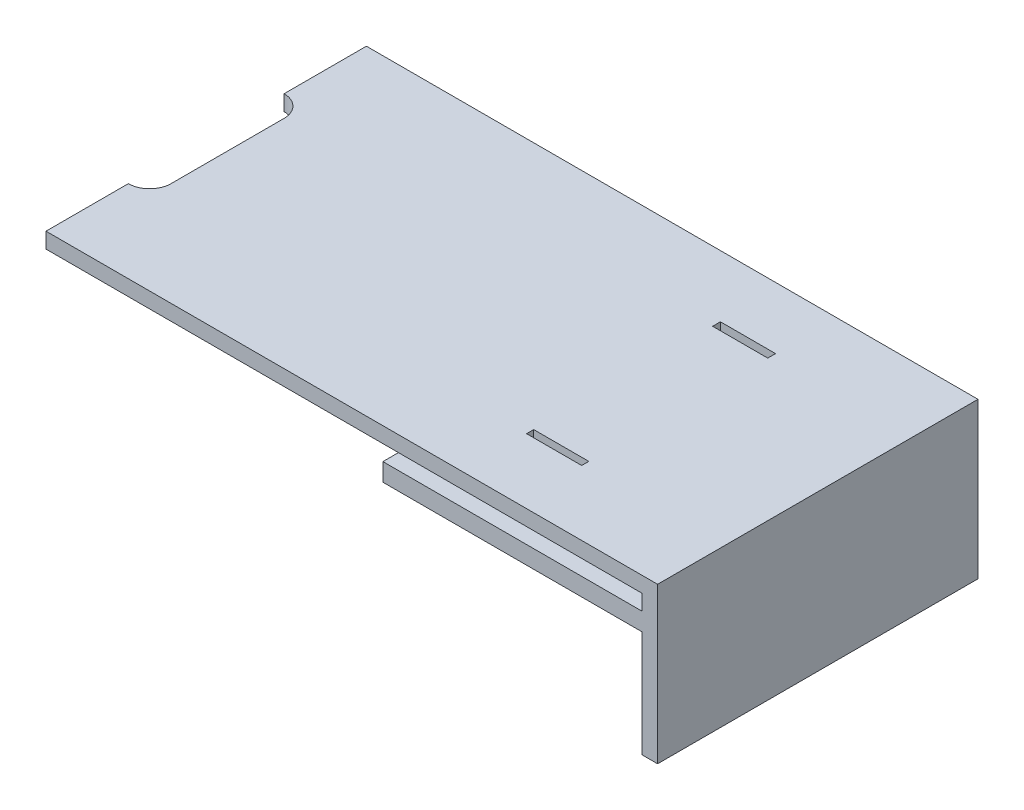
from build123d import *

# Parameters (mm, degrees)
SKETCH1_W            = 115
SKETCH1_H            = 61.82
BOSS_EXTRUDE1_DEPTH  = 3
CUT_EXTRUDE1_DEPTH   = 3
SKETCH3_W            = 61.82
SKETCH3_H            = 30
BOSS_EXTRUDE2_DEPTH  = 3
SKETCH4_W            = 10
SKETCH4_H            = 3.45
BOSS_EXTRUDE3_DEPTH  = 50
SKETCH5_W            = 6
SKETCH5_H            = 2
SKETCH5_W_2          = 2
SKETCH5_H_2          = 6
BOSS_EXTRUDE12_DEPTH = 5
SKETCH8_W            = 10.631694969
SKETCH8_H            = 1.375866407
SKETCH8_H_2          = 1.500945172
CUT_EXTRUDE2_DEPTH   = 5


with BuildPart() as part:
    # Sketch1 → Boss-Extrude1 (new body)
    with BuildSketch(Plane(origin=(0, 0, 0), x_dir=(1, 0, 0), z_dir=(0, 1, 0))):
        Rectangle(SKETCH1_W, SKETCH1_H)
    extrude(amount=BOSS_EXTRUDE1_DEPTH)

    # Sketch2 → Cut-Extrude1 (cut)
    with BuildSketch(Plane(origin=(0, 3, 0), x_dir=(1, 0, 0), z_dir=(0, 1, 0))):
        with BuildLine():
            Line((-57.5, -10.91), (-57.5, -15.029841252))
            ThreePointArc((-57.5, -15.029841252), (-54.586832313, -13.823167687), (-53.380158748, -10.91))
            Line((-53.380158748, -10.91), (-53.380158748, 10.91))
            ThreePointArc((-53.380158748, 10.91), (-54.586832313, 13.823167687), (-57.5, 15.029841252))
            Line((-57.5, 15.029841252), (-57.5, 10.91))
            Line((-57.5, 10.91), (-57.5, -10.91))
        make_face()
    extrude(amount=-CUT_EXTRUDE1_DEPTH, mode=Mode.SUBTRACT)

    # Sketch3 → Boss-Extrude2 (add)
    with BuildSketch(Plane(origin=(57.5, 0, 0), x_dir=(0, 0, -1), z_dir=(1, 0, 0))):
        with Locations((0, -12)):
            Rectangle(SKETCH3_W, SKETCH3_H)
    extrude(amount=BOSS_EXTRUDE2_DEPTH)

    # Sketch4 → Boss-Extrude3 (add)
    with BuildSketch(Plane.ZY.offset(-57.5)):
        with Locations((25.91, -4.725)):
            Rectangle(SKETCH4_W, SKETCH4_H)
    boss_extrude3 = extrude(amount=BOSS_EXTRUDE3_DEPTH)

    # Mirror1: Boss-Extrude3 across plane
    add(boss_extrude3.mirror(Plane.XY))

    # Sketch5 → Boss-Extrude12 (add)
    with BuildSketch(Plane.XZ):
        with Locations((46, -14.25)):
            Rectangle(SKETCH5_W, SKETCH5_H)
        with Locations((3, -14.25)):
            Rectangle(SKETCH5_W, SKETCH5_H)
        with Locations((-1, 10.25)):
            Rectangle(SKETCH5_W_2, SKETCH5_H_2)
        with Locations((50, 10.25)):
            Rectangle(SKETCH5_W_2, SKETCH5_H_2)
    extrude(amount=BOSS_EXTRUDE12_DEPTH)

    # Sketch8 → Cut-Extrude2 (cut)
    with BuildSketch(Plane.XZ):
        with Locations((28.01669804, 17.698645154)):
            Rectangle(SKETCH8_W, SKETCH8_H)
        with Locations((28.01669804, -18.261499593)):
            Rectangle(SKETCH8_W, SKETCH8_H_2)
    extrude(amount=-CUT_EXTRUDE2_DEPTH, mode=Mode.SUBTRACT)


solid = part.part
